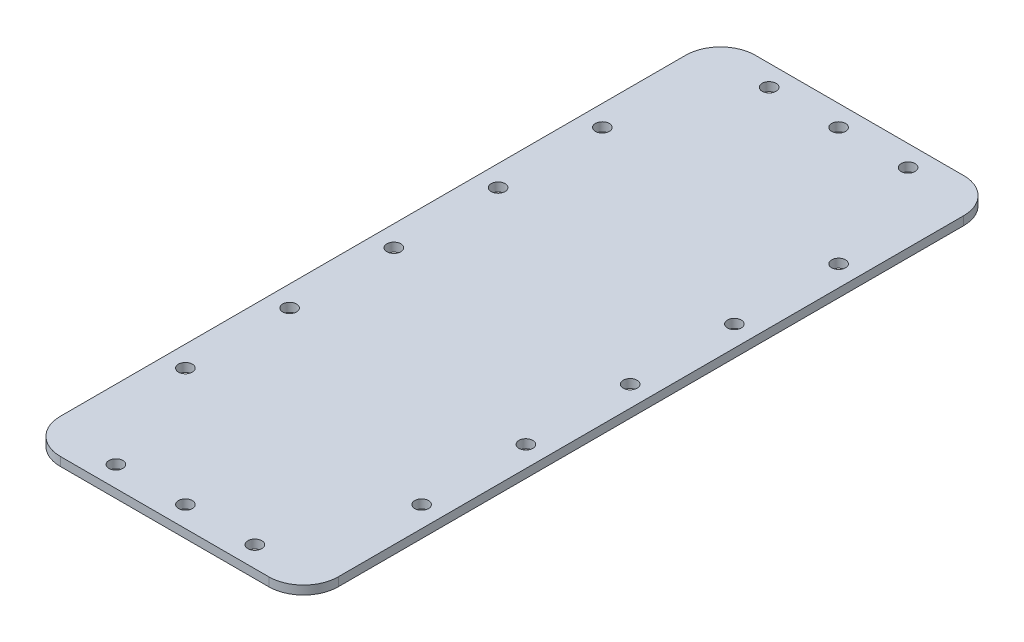
from build123d import *

# Parameters (mm, degrees)
SKETCH1_W           = 101.6
SKETCH1_H           = 254
BOSS_EXTRUDE1_DEPTH = 3.175
SKETCH2_R           = 2.54
CUT_EXTRUDE1_DEPTH  = 223.663234681
FILLET1_R           = 12.7


with BuildPart() as part:
    # Sketch1 → Boss-Extrude1 (new body)
    with BuildSketch(Plane(origin=(0, 0, 0), x_dir=(1, 0, 0), z_dir=(0, 1, 0))):
        with Locations((20.100372359, -84.049692378)):
            Rectangle(SKETCH1_W, SKETCH1_H)
    extrude(amount=BOSS_EXTRUDE1_DEPTH)

    # Sketch2 → Cut-Extrude1 (cut, through all)
    with BuildSketch(Plane(origin=(0, 3.175, 0), x_dir=(1, 0, 0), z_dir=(0, 1, 0))):
        with Locations(Location((-5.299627641, 35.330307622, 0), (0, 0, 270))):
            Circle(SKETCH2_R)
        with Locations(Location((20.100372359, 35.330307622, 0), (0, 0, 270))):
            Circle(SKETCH2_R)
        with Locations(Location((45.500372359, 35.330307622, 0), (0, 0, 270))):
            Circle(SKETCH2_R)
        with Locations(Location((-23.079627641, -84.049692378, 0), (0, 0, 270))):
            Circle(SKETCH2_R)
        with Locations(Location((-23.079627641, -45.949692378, 0), (0, 0, 270))):
            Circle(SKETCH2_R)
        with Locations(Location((-23.079627641, -7.849692378, 0), (0, 0, 270))):
            Circle(SKETCH2_R)
        with Locations(Location((63.280372359, -7.849692378, 0), (0, 0, 90))):
            Circle(SKETCH2_R)
        with Locations(Location((63.280372359, -45.949692378, 0), (0, 0, 90))):
            Circle(SKETCH2_R)
        with Locations(Location((63.280372359, -84.049692378, 0), (0, 0, 90))):
            Circle(SKETCH2_R)
        with Locations(Location((63.280372359, -122.149692378, 0), (0, 0, 270))):
            Circle(SKETCH2_R)
        with Locations(Location((63.280372359, -160.249692378, 0), (0, 0, 270))):
            Circle(SKETCH2_R)
        with Locations(Location((-23.079627641, -160.249692378, 0), (0, 0, 90))):
            Circle(SKETCH2_R)
        with Locations(Location((-23.079627641, -122.149692378, 0), (0, 0, 90))):
            Circle(SKETCH2_R)
        with Locations(Location((45.500372359, -203.429692378, 0), (0, 0, 90))):
            Circle(SKETCH2_R)
        with Locations(Location((20.100372359, -203.429692378, 0), (0, 0, 90))):
            Circle(SKETCH2_R)
        with Locations(Location((-5.299627641, -203.429692378, 0), (0, 0, 90))):
            Circle(SKETCH2_R)
    extrude(amount=-CUT_EXTRUDE1_DEPTH, mode=Mode.SUBTRACT)

    # Fillet1
    fillet1_edges = [part.edges().sort_by_distance(p)[0] for p in [
        (-30.699627641, 1.5875, -42.950307622),
        (70.900372359, 1.5875, -42.950307622),
        (70.900372359, 1.5875, 211.049692378),
        (-30.699627641, 1.5875, 211.049692378),
    ]]
    fillet(fillet1_edges, radius=FILLET1_R)


solid = part.part
